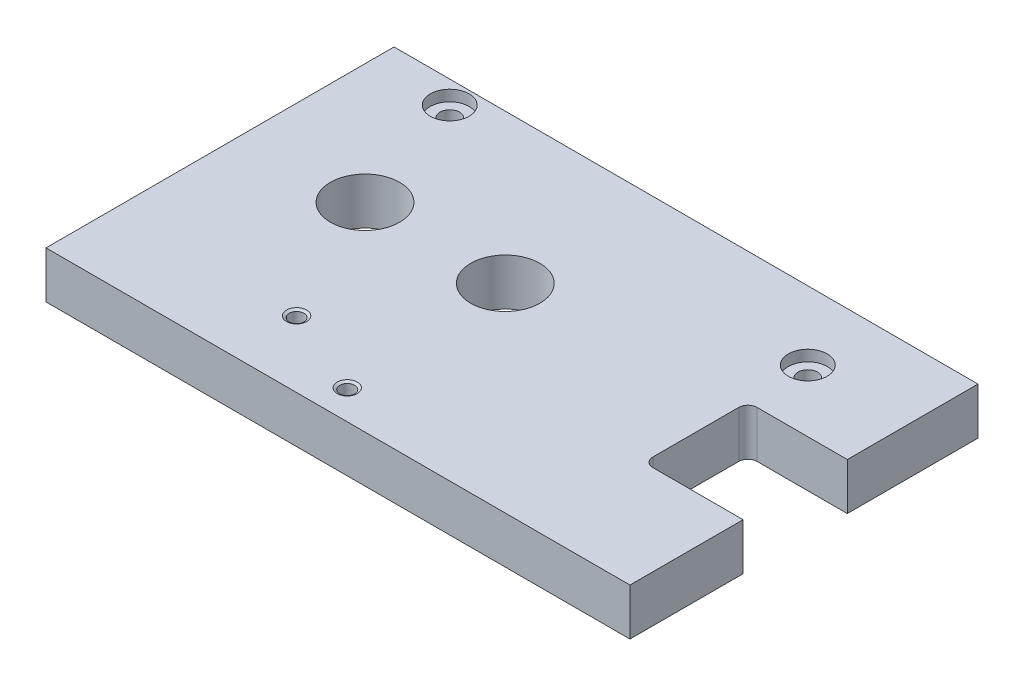
from build123d import *

# Parameters (mm, degrees)
SKETCH1_W           = 160
SKETCH1_H           = 95.37
BOSS_EXTRUDE3_DEPTH = 12.83
HOLE1_D             = 18.97
SKETCH4_W           = 27.24
SKETCH4_H           = 28.56
CUT_EXTRUDE1_DEPTH  = 187.708451335
FILLET1_R           = 2.5
HOLE2_D             = 5.35
HOLE2_CBORE_D       = 10.65
HOLE2_CBORE_DEPTH   = 3
HOLE3_D             = 4.08
HOLE3_CSINK_D       = 5.5
HOLE3_CSINK_ANGLE   = 120
SKETCH10_R          = 9.525
CUT_EXTRUDE2_DEPTH  = 3.301941
SKETCH11_R          = 5.08
CUT_EXTRUDE3_DEPTH  = 3.175


with BuildPart() as part:
    # Sketch1 → Boss-Extrude3 (new body)
    with BuildSketch(Plane(origin=(0, 0, 0), x_dir=(1, 0, 0), z_dir=(0, 1, 0))):
        with Locations((80, -47.685)):
            Rectangle(SKETCH1_W, SKETCH1_H)
    extrude(amount=BOSS_EXTRUDE3_DEPTH)

    # Hole1 (through all)
    with Locations(Plane(origin=(0, 12.83, 0), x_dir=(-1, 0, 0), z_dir=(0, 1, 0))):
        with Locations((-32.885, 40.845), (-71.315, 40.845)):
            Hole(HOLE1_D / 2)

    # Sketch4 → Cut-Extrude1 (cut, through all)
    with BuildSketch(Plane(origin=(0, 12.83, 0), x_dir=(-1, 0, 0), z_dir=(0, 1, 0))):
        with Locations((-146.38, 50.09)):
            Rectangle(SKETCH4_W, SKETCH4_H)
    extrude(amount=-CUT_EXTRUDE1_DEPTH, mode=Mode.SUBTRACT)

    # Fillet1
    fillet1_edges = [part.edges().sort_by_distance(p)[0] for p in [
        (132.76, 6.415, 64.37),
        (132.76, 6.415, 35.81),
    ]]
    fillet(fillet1_edges, radius=FILLET1_R)

    # Hole2 (through all)
    with Locations(Plane(origin=(0, 12.83, 0), x_dir=(-1, 0, 0), z_dir=(0, 1, 0))):
        with Locations((-21.425, 6.17), (-132.175, 18.815)):
            CounterBoreHole(HOLE2_D / 2, HOLE2_CBORE_D / 2, HOLE2_CBORE_DEPTH)

    # Hole3 (through all)
    with Locations(Plane(origin=(0, 12.83, 0), x_dir=(-1, 0, 0), z_dir=(0, 1, 0))):
        with Locations((-50.46, 77.16), (-74.48, 87.31)):
            CounterSinkHole(HOLE3_D / 2, HOLE3_CSINK_D / 2, counter_sink_angle=HOLE3_CSINK_ANGLE)

    # Sketch10 → Cut-Extrude2 (cut)
    with BuildSketch(Plane.XZ):
        with Locations(Location((132.175, 18.815, 0), (0, 0, 270))):
            Circle(SKETCH10_R)
    extrude(amount=-CUT_EXTRUDE2_DEPTH, mode=Mode.SUBTRACT)

    # Sketch11 → Cut-Extrude3 (cut)
    with BuildSketch(Plane.XZ):
        with Locations(Location((21.425, 6.17, 0), (0, 0, 270))):
            Circle(SKETCH11_R)
    extrude(amount=-CUT_EXTRUDE3_DEPTH, mode=Mode.SUBTRACT)


solid = part.part
